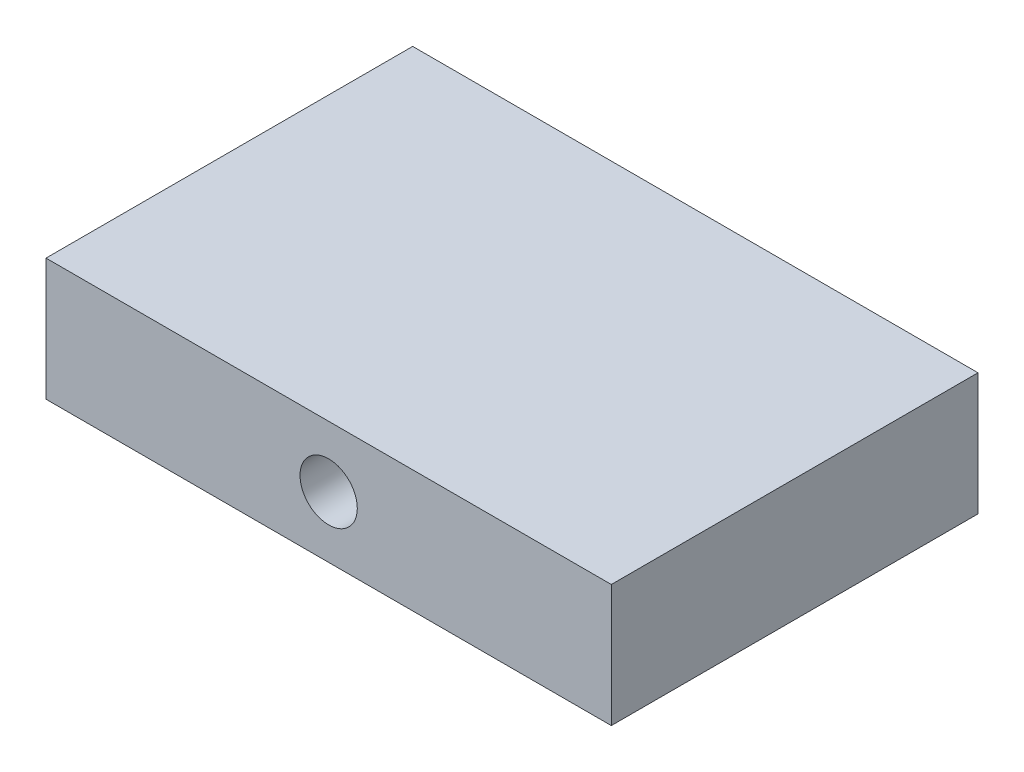
from build123d import *

# Parameters (mm, degrees)
SKETCH2_W           = 74
SKETCH2_H           = 48
BOSS_EXTRUDE1_DEPTH = 16
SKETCH3_R           = 3.75
CUT_EXTRUDE1_DEPTH  = 63.681735777


with BuildPart() as part:
    # Sketch2 → Boss-Extrude1 (new body)
    with BuildSketch(Plane(origin=(0, 0, 0), x_dir=(1, 0, 0), z_dir=(0, 1, 0))):
        Rectangle(SKETCH2_W, SKETCH2_H)
    extrude(amount=BOSS_EXTRUDE1_DEPTH)

    # Sketch3 → Cut-Extrude1 (cut, through all)
    with BuildSketch(Plane.XY.offset(24)):
        with Locations((0, 8)):
            Circle(SKETCH3_R)
    extrude(amount=-CUT_EXTRUDE1_DEPTH, mode=Mode.SUBTRACT)


solid = part.part
